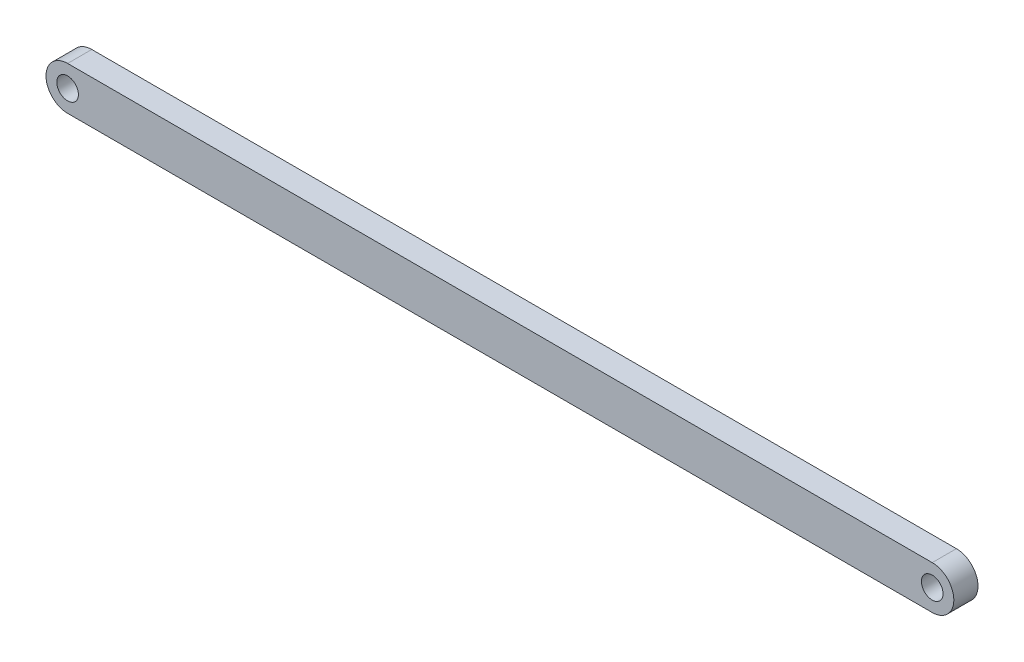
from build123d import *

# Parameters (mm, degrees)
BOSS_EXTRUDE1_DEPTH      = 1.42
BOSS_EXTRUDE1_DEPTH_BACK = 1.42
SKETCH1_R                = 1.27


with BuildPart() as part:
    # Sketch1 → Boss-Extrude1 (new, two sides: drawn at the far end of the back side and taken through both)
    with BuildSketch(Plane.XY.offset(-BOSS_EXTRUDE1_DEPTH_BACK)):
        with BuildLine():
            Line((-50.8, 2.54), (50.8, 2.54))
            ThreePointArc((50.8, 2.54), (53.34, 0), (50.8, -2.54))
            Line((50.8, -2.54), (-50.8, -2.54))
            ThreePointArc((-50.8, -2.54), (-53.34, 0), (-50.8, 2.54))
        make_face()
        with Locations((-50.8, 0)):
            Circle(SKETCH1_R, mode=Mode.SUBTRACT)
        with Locations((50.8, 0)):
            Circle(SKETCH1_R, mode=Mode.SUBTRACT)
    extrude(amount=BOSS_EXTRUDE1_DEPTH + BOSS_EXTRUDE1_DEPTH_BACK)


solid = part.part
